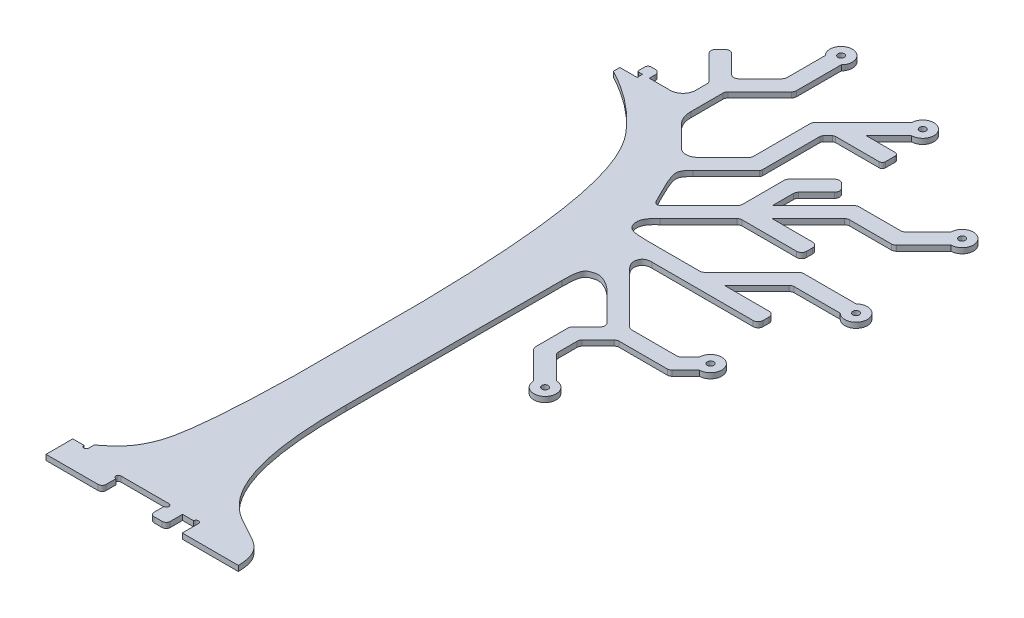
from build123d import *

# Parameters (mm, degrees)
SKETCH1_R           = 4
BOSS_EXTRUDE1_DEPTH = 6.7


with BuildPart() as part:
    # Sketch1 → Boss-Extrude1 (new body)
    with BuildSketch(Plane(origin=(0, 0, 0), x_dir=(1, 0, 0), z_dir=(0, 1, 0))):
        with BuildLine():
            Line((0, 40.1), (0, 33.4))
            ThreePointArc((0, 33.4), (-3.05, 30.35), (-6.1, 33.4))
            Line((-6.1, 33.4), (-20, 33.4))
            Line((-20, 33.4), (-20, 0))
            Line((-20, 0), (0, 0))
            Line((0, 0), (45, 0))
            ThreePointArc((45, 0), (48.535533906, 1.464466094), (50, 5))
            Line((50, 5), (50, 17.3))
            ThreePointArc((50, 17.3), (46.95, 20.35), (50, 23.4))
            Line((50, 23.4), (110, 23.4))
            ThreePointArc((110, 23.4), (113.05, 20.35), (110, 17.3))
            Line((110, 17.3), (110, 5))
            ThreePointArc((110, 5), (111.464466094, 1.464466094), (115, 0))
            Line((115, 0), (125, 0))
            ThreePointArc((125, 0), (128.535533906, 1.464466094), (130, 5))
            Line((130, 5), (130, 20.35))
            Line((130, 20.35), (143.9, 20.35))
            ThreePointArc((143.9, 20.35), (146.95, 23.4), (150, 20.35))
            Line((150, 20.35), (150, 0))
            Line((150, 0), (220, 0))
            add(Edge.make_bspline(
                [(220, 0), (219.890907691, 29.659355037), (199.182654128, 36.818322439), (129.434173903, 76.078651286), (113.741949139, 150.60342466), (114, 240)],
                knots=[0, 0, 0, 0, 0.323231808, 0.423231808, 1, 1, 1, 1], degree=3))
            Line((114, 240), (114, 510))
            add(Edge.make_bspline(
                [(114, 510), (113.551620448, 535.633454215), (120.895422526, 535.801422354), (132.144718036, 540.677022534), (144.848324985, 535.109601355), (154, 526)],
                knots=[0, 0, 0, 0, 0.414772641, 0.514772641, 1, 1, 1, 1], degree=3))
            Line((154, 526), (187.941125497, 492.058874503))
            ThreePointArc((187.941125497, 492.058874503), (189.757063454, 487.67481246), (187.941125497, 483.290750416))
            Line((187.941125497, 483.290750416), (170.970562748, 466.320187668))
            ThreePointArc((170.970562748, 466.320187668), (169.62657169, 464.308762905), (169.154624792, 461.936125625))
            Line((169.154624792, 461.936125625), (169.154624792, 421.936125625))
            ThreePointArc((169.154624792, 421.936125625), (169.62657169, 419.563488344), (170.970562748, 417.552063581))
            Line((170.970562748, 417.552063581), (204.911688245, 383.610938084))
            ThreePointArc((204.911688245, 383.610938084), (228.810454224, 373.854307729), (219.053823869, 397.753073708))
            Line((219.053823869, 397.753073708), (190.970562748, 425.836334829))
            ThreePointArc((190.970562748, 425.836334829), (189.62657169, 427.847759591), (189.154624792, 430.220396872))
            Line((189.154624792, 430.220396872), (189.154624792, 453.651854377))
            ThreePointArc((189.154624792, 453.651854377), (189.62657169, 456.024491658), (190.970562748, 458.03591642))
            Line((190.970562748, 458.03591642), (210.935656455, 478.001010127))
            ThreePointArc((210.935656455, 478.001010127), (212.947081218, 479.345001185), (215.319718498, 479.816948083))
            Line((215.319718498, 479.816948083), (275.319718498, 479.816948083))
            ThreePointArc((275.319718498, 479.816948083), (277.692355779, 480.288894982), (279.703780542, 481.63288604))
            Line((279.703780542, 481.63288604), (296.67434329, 498.603448789))
            ThreePointArc((296.67434329, 498.603448789), (306.430973645, 522.502214767), (282.532207666, 512.745584412))
            Line((282.532207666, 512.745584412), (271.419509294, 501.63288604))
            ThreePointArc((271.419509294, 501.63288604), (269.408084531, 500.288894982), (267.035447251, 499.816948083))
            Line((267.035447251, 499.816948083), (211.035447251, 499.816948083))
            ThreePointArc((211.035447251, 499.816948083), (208.66280997, 500.288894982), (206.651385207, 501.63288604))
            Line((206.651385207, 501.63288604), (146.547308807, 561.736962441))
            add(Edge.make_bspline(
                [(146.547308807, 561.736962441), (141.632963052, 565.943105259), (137.260490902, 571.484861967), (139.665267004, 583.567286396), (144.91664492, 585.845642561), (150.547308807, 585.736962441)],
                knots=[0, 0, 0, 0, 0.464051592, 0.564051592, 1, 1, 1, 1], degree=3))
            Line((150.547308807, 585.736962441), (276.547308807, 585.736962441))
            ThreePointArc((276.547308807, 585.736962441), (280.93137085, 587.552900398), (282.747308807, 591.936962441))
            Line((282.747308807, 591.936962441), (282.747308807, 599.536962441))
            ThreePointArc((282.747308807, 599.536962441), (280.93137085, 603.921024484), (276.547308807, 605.736962441))
            Line((276.547308807, 605.736962441), (220.747308807, 605.736962441))
            Line((220.747308807, 605.736962441), (261.156767594, 646.146421229))
            ThreePointArc((261.156767594, 646.146421229), (263.168192357, 647.490412287), (265.540829638, 647.962359185))
            Line((265.540829638, 647.962359185), (322.972705551, 647.962359185))
            ThreePointArc((322.972705551, 647.962359185), (346.770664522, 657.962359185), (322.972705551, 667.962359185))
            Line((322.972705551, 667.962359185), (257.25655839, 667.962359185))
            ThreePointArc((257.25655839, 667.962359185), (254.88392111, 667.490412287), (252.872496347, 666.146421229))
            Line((252.872496347, 666.146421229), (194.278975516, 607.552900398))
            ThreePointArc((194.278975516, 607.552900398), (192.267550753, 606.208909339), (189.894913472, 605.736962441))
            Line((189.894913472, 605.736962441), (124.463037559, 605.736962441))
            add(Edge.make_bspline(
                [(124.463037559, 605.736962441), (105.379278594, 605.715784112), (100.68373047, 608.302316111), (94.628964185, 623.119994507), (100.405113527, 630.945904726), (108.463037559, 637.736962441)],
                knots=[0, 0, 0, 0, 0.366767734, 0.366767734, 1, 1, 1, 1], degree=3))
            Line((108.463037559, 637.736962441), (156.54629868, 685.820223562))
            ThreePointArc((156.54629868, 685.820223562), (158.557723442, 687.16421462), (160.930360723, 687.636161518))
            Line((160.930360723, 687.636161518), (228.930360723, 687.636161518))
            ThreePointArc((228.930360723, 687.636161518), (233.314422766, 689.452099475), (235.130360723, 693.836161518))
            Line((235.130360723, 693.836161518), (235.130360723, 701.436161518))
            ThreePointArc((235.130360723, 701.436161518), (233.314422766, 705.820223562), (228.930360723, 707.636161518))
            Line((228.930360723, 707.636161518), (178.362236636, 707.636161518))
            Line((178.362236636, 707.636161518), (223.617070632, 752.890995514))
            ThreePointArc((223.617070632, 752.890995514), (225.628495395, 754.234986572), (228.001132676, 754.706933471))
            Line((228.001132676, 754.706933471), (280.001132676, 754.706933471))
            ThreePointArc((280.001132676, 754.706933471), (282.373769956, 755.178880369), (284.385194719, 756.522871427))
            Line((284.385194719, 756.522871427), (318.527330343, 790.665007051))
            ThreePointArc((318.527330343, 790.665007051), (328.283960698, 814.56377303), (304.385194719, 804.807142675))
            Line((304.385194719, 804.807142675), (276.100923472, 776.522871427))
            ThreePointArc((276.100923472, 776.522871427), (274.089498709, 775.178880369), (271.716861428, 774.706933471))
            Line((271.716861428, 774.706933471), (219.716861428, 774.706933471))
            ThreePointArc((219.716861428, 774.706933471), (217.344224148, 774.234986572), (215.332799385, 772.890995514))
            Line((215.332799385, 772.890995514), (164.421111139, 721.979307269))
            Line((164.421111139, 721.979307269), (164.421111139, 748.263160108))
            ThreePointArc((164.421111139, 748.263160108), (164.893058038, 750.635797389), (166.237049096, 752.647222151))
            Line((166.237049096, 752.647222151), (188.663455967, 775.073629023))
            ThreePointArc((188.663455967, 775.073629023), (190.479393924, 779.457691066), (188.663455967, 783.841753109))
            Line((188.663455967, 783.841753109), (183.28944443, 789.215764646))
            ThreePointArc((183.28944443, 789.215764646), (178.905382387, 791.031702603), (174.521320344, 789.215764646))
            Line((174.521320344, 789.215764646), (146.237049096, 760.931493399))
            ThreePointArc((146.237049096, 760.931493399), (144.893058038, 758.920068636), (144.421111139, 756.547431355))
            Line((144.421111139, 756.547431355), (144.421111139, 704.547431355))
            ThreePointArc((144.421111139, 704.547431355), (143.949164241, 702.174794075), (142.605173183, 700.163369312))
            Line((142.605173183, 700.163369312), (96.643232406, 654.201428535))
            add(Edge.make_bspline(
                [(76.970562748, 710.474603256), (66.746568937, 700.332773062), (66.067301258, 696.630486853), (89.013361187, 650.103947446), (89.680566702, 647.96664092), (96.643232406, 654.201428535)],
                knots=[0, 0, 0, 0, 0.497957921, 0.597957921, 1, 1, 1, 1], degree=3))
            Line((76.970562748, 710.474603256), (118.225396744, 751.729437252))
            ThreePointArc((118.225396744, 751.729437252), (119.09248775, 753.027130647), (119.39696962, 754.557864376))
            Line((119.39696962, 754.557864376), (119.39696962, 826.244155877))
            ThreePointArc((119.39696962, 826.244155877), (119.70145149, 827.774889607), (120.568542495, 829.072583002))
            Line((120.568542495, 829.072583002), (126.308657865, 834.812698372))
            ThreePointArc((126.308657865, 834.812698372), (127.60635126, 835.679789378), (129.13708499, 835.984271247))
            Line((129.13708499, 835.984271247), (183.48023074, 835.984271247))
            ThreePointArc((183.48023074, 835.984271247), (186.308657865, 837.155844123), (187.48023074, 839.984271247))
            Line((187.48023074, 839.984271247), (187.48023074, 851.984271247))
            ThreePointArc((187.48023074, 851.984271247), (186.308657865, 854.812698372), (183.48023074, 855.984271247))
            Line((183.48023074, 855.984271247), (147.48023074, 855.984271247))
            Line((147.48023074, 855.984271247), (175.764501988, 884.268542495))
            ThreePointArc((175.764501988, 884.268542495), (185.521132343, 908.167308474), (161.622366364, 898.410678119))
            Line((161.622366364, 898.410678119), (100.568542495, 837.356854249))
            ThreePointArc((100.568542495, 837.356854249), (99.70145149, 836.059160854), (99.39696962, 834.528427125))
            Line((99.39696962, 834.528427125), (99.39696962, 762.842135624))
            ThreePointArc((99.39696962, 762.842135624), (99.09248775, 761.311401894), (98.225396744, 760.013708499))
            Line((98.225396744, 760.013708499), (65.455844123, 727.244155877))
            ThreePointArc((65.455844123, 727.244155877), (55.455844123, 723.102020254), (45.455844123, 727.244155877))
            Line((45.455844123, 727.244155877), (20, 752.7))
            ThreePointArc((20, 752.7), (13.94742298, 761.878969192), (12, 772.7))
            Line((12, 772.7), (12, 812.7))
            ThreePointArc((12, 812.7), (12.471946898, 815.072637281), (13.815937957, 817.084062043))
            Line((13.815937957, 817.084062043), (53.413917703, 856.68204179))
            ThreePointArc((53.413917703, 856.68204179), (54.757908761, 858.693466552), (55.22985566, 861.066103833))
            Line((55.22985566, 861.066103833), (55.22985566, 917.066103833))
            ThreePointArc((55.22985566, 917.066103833), (45.22985566, 940.864062804), (35.22985566, 917.066103833))
            Line((35.22985566, 917.066103833), (35.22985566, 869.350375081))
            ThreePointArc((35.22985566, 869.350375081), (34.757908761, 866.9777378), (33.413917703, 864.966313037))
            Line((33.413917703, 864.966313037), (6.384062043, 837.936457378))
            ThreePointArc((6.384062043, 837.936457378), (2, 836.120519421), (-2.384062043, 837.936457378))
            Line((-2.384062043, 837.936457378), (-25.372287143, 860.924682477))
            ThreePointArc((-25.372287143, 860.924682477), (-29.756349186, 862.740620434), (-34.140411229, 860.924682477))
            Line((-34.140411229, 860.924682477), (-39.514422766, 855.55067094))
            ThreePointArc((-39.514422766, 855.55067094), (-41.330360723, 851.166608897), (-39.514422766, 846.782546853))
            Line((-39.514422766, 846.782546853), (-9.815937957, 817.084062043))
            ThreePointArc((-9.815937957, 817.084062043), (-8.471946898, 815.072637281), (-8, 812.7))
            Line((-8, 812.7), (-8, 798.7))
            ThreePointArc((-8, 798.7), (-12.686291501, 787.386291501), (-24, 782.7))
            Line((-24, 782.7), (-40, 782.7))
            Line((-40, 782.7), (-50, 782.7))
            Line((-50, 782.7), (-50, 790.1))
            ThreePointArc((-50, 790.1), (-51.757359313, 794.342640687), (-56, 796.1))
            Line((-56, 796.1), (-61, 796.1))
            ThreePointArc((-61, 796.1), (-63.828427125, 794.928427125), (-65, 792.1))
            Line((-65, 792.1), (-65, 784.7))
            ThreePointArc((-65, 784.7), (-64.414213562, 783.285786438), (-63, 782.7))
            Line((-63, 782.7), (-58.475, 782.7))
            Line((-58.475, 782.7), (-58.475, 776))
            Line((-58.475, 776), (-65, 776))
            Line((-65, 776), (-80, 776))
            Line((-80, 776), (-80, 768))
            add(Edge.make_bspline(
                [(50, 400), (47.658546165, 541.153999781), (33.196120556, 666.543503362), (-32.247269456, 739.195121809), (-56.446473332, 755.112201281), (-80, 768)],
                knots=[0, 0, 0, 0, 0.54734267, 0.64734267, 1, 1, 1, 1], degree=3))
            Line((50, 400), (50, 240))
            add(Edge.make_bspline(
                [(0, 40.1), (19.195681574, 54.426798904), (27.876718195, 66.544308046), (42.020426881, 101.0239304), (48.213782321, 152.248076268), (50, 240)],
                knots=[0, 0, 0, 0, 0.453257263, 0.553257263, 1, 1, 1, 1], degree=3))
        make_face()
        with Locations(Location((218.910959288, 383.753802666, 0), (0, 0, 270))):
            Circle(SKETCH1_R, mode=Mode.SUBTRACT)
        with Locations(Location((45.22985566, 926.864062804, 0), (0, 0, 270))):
            Circle(SKETCH1_R, mode=Mode.SUBTRACT)
        with Locations(Location((296.531478708, 512.602719831, 0), (0, 0, 270))):
            Circle(SKETCH1_R, mode=Mode.SUBTRACT)
        with Locations(Location((332.770664522, 657.962359185, 0), (0, 0, 270))):
            Circle(SKETCH1_R, mode=Mode.SUBTRACT)
        with Locations(Location((175.621637406, 898.267813537, 0), (0, 0, 270))):
            Circle(SKETCH1_R, mode=Mode.SUBTRACT)
        with Locations(Location((318.384465761, 804.664278093, 0), (0, 0, 270))):
            Circle(SKETCH1_R, mode=Mode.SUBTRACT)
    extrude(amount=BOSS_EXTRUDE1_DEPTH)


solid = part.part
